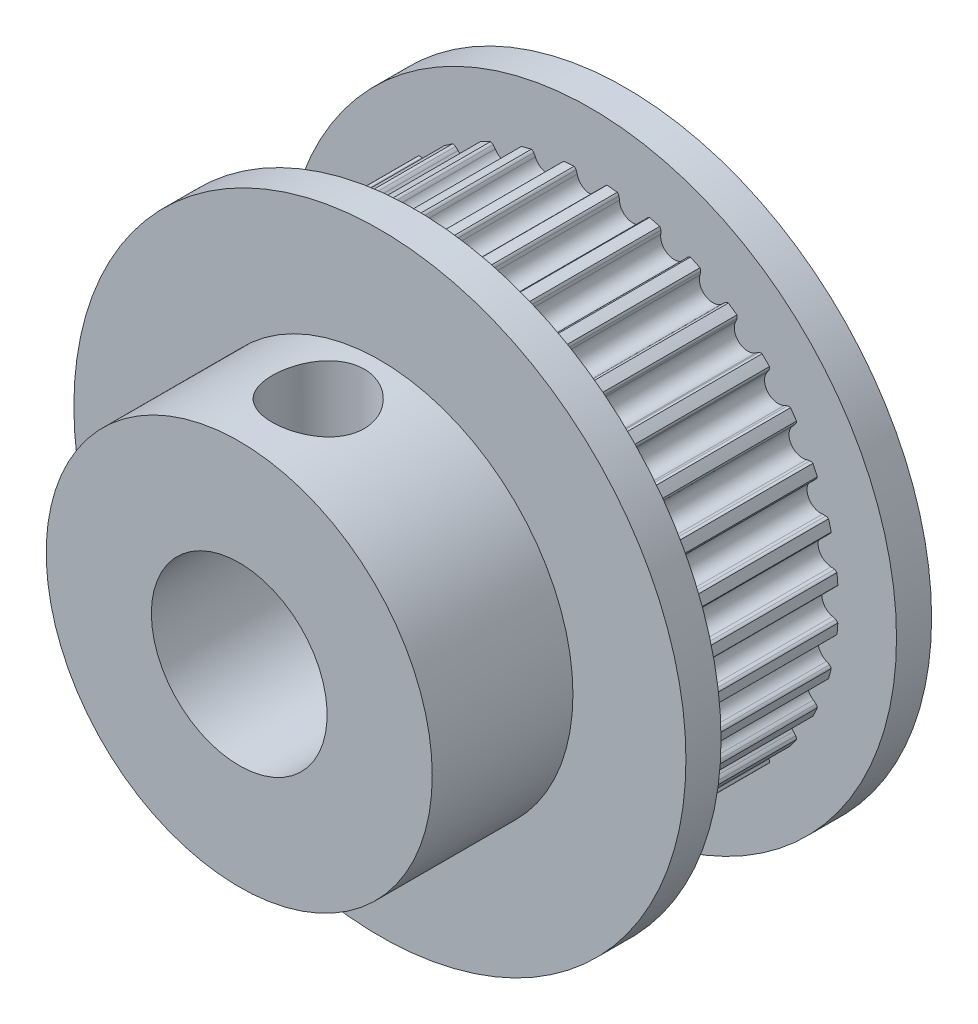
from build123d import *

# Parameters (mm, degrees)
SKETCH1_W            = 13.843
SKETCH1_H            = 1.5875
BOSS_EXTRUDE1_DEPTH  = 7.9375
BOSS_EXTRUDE2_START  = -1.5875
SKETCH3_R            = 13.843
BOSS_EXTRUDE2_DEPTH  = 1.5875
SKETCH4_R            = 8.73125
BOSS_EXTRUDE3_DEPTH  = 6.3627
M7_CLEARANCE_HOLE1_D = 7.9502
SKETCH7_W            = 2.0828
SKETCH7_H            = 10.457240976


with BuildPart() as part:
    # Sketch1 → Revolve1 (revolve)
    with BuildSketch(Plane(origin=(0, 0, 0), x_dir=(1, 0, 0), z_dir=(0, 1, 0))):
        with Locations((6.9215, -4.7625)):
            Rectangle(SKETCH1_W, SKETCH1_H)
    revolve(axis=Axis((0, 0, 3.96875), (0, 0, 1)))

    # Sketch2 → Boss-Extrude1 (add)
    with BuildSketch(Plane(origin=(0, 0, 3.96875), x_dir=(-1, 0, 0), z_dir=(0, 0, -1))):
        with BuildLine():
            ThreePointArc((-3.130872157, 10.768178971), (-2.902422654, 10.831988809), (-2.672674661, 10.89095262))
            ThreePointArc((-2.672674661, 10.89095262), (-2.613516844, 10.858268025), (-2.566342482, 10.809868545))
            ThreePointArc((-2.566342482, 10.809868545), (-2.525361974, 10.745532294), (-2.492197715, 10.676839592))
            ThreePointArc((-2.492197715, 10.676839592), (-1.81719345, 10.305816174), (-1.309794405, 10.885329198))
            ThreePointArc((-1.309794405, 10.885329198), (-1.302124483, 10.961222067), (-1.285619696, 11.035694527))
            ThreePointArc((-1.285619696, 11.035694527), (-1.257843893, 11.097309743), (-1.213432519, 11.148256381))
            ThreePointArc((-1.213432519, 11.148256381), (-0.977373215, 11.171426964), (-0.740876652, 11.189599662))
            ThreePointArc((-0.740876652, 11.189599662), (-0.688293196, 11.147138972), (-0.65024, 11.091283047))
            ThreePointArc((-0.65024, 11.091283047), (-0.62105395, 11.020808018), (-0.600321894, 10.9474))
            ThreePointArc((-0.600321894, 10.9474), (0, 10.4648), (0.600321894, 10.9474))
            ThreePointArc((0.600321894, 10.9474), (0.62105395, 11.020808018), (0.65024, 11.091283047))
            ThreePointArc((0.65024, 11.091283047), (0.688293196, 11.147138972), (0.740876652, 11.189599662))
            ThreePointArc((0.740876652, 11.189599662), (0.977373215, 11.171426964), (1.213432519, 11.148256381))
            ThreePointArc((1.213432519, 11.148256381), (1.257843893, 11.097309743), (1.285619696, 11.035694527))
            ThreePointArc((1.285619696, 11.035694527), (1.302124483, 10.961222067), (1.309794405, 10.885329198))
            ThreePointArc((1.309794405, 10.885329198), (1.81719345, 10.305816174), (2.492197715, 10.676839592))
            ThreePointArc((2.492197715, 10.676839592), (2.525361974, 10.745532294), (2.566342482, 10.809868545))
            ThreePointArc((2.566342482, 10.809868545), (2.613516844, 10.858268025), (2.672674661, 10.89095262))
            ThreePointArc((2.672674661, 10.89095262), (2.902422654, 10.831988809), (3.130872157, 10.768178971))
            ThreePointArc((3.130872157, 10.768178971), (3.165762032, 10.710294373), (3.182416488, 10.644792012))
            ThreePointArc((3.182416488, 10.644792012), (3.185738524, 10.56858493), (3.180113263, 10.492513177))
            ThreePointArc((3.180113263, 10.492513177), (3.579172396, 9.833695338), (4.308349371, 10.081868817))
            ThreePointArc((4.308349371, 10.081868817), (4.352938152, 10.143759008), (4.404467947, 10.200001656))
            ThreePointArc((4.404467947, 10.200001656), (4.459330106, 10.239474098), (4.523264803, 10.261389493))
            ThreePointArc((4.523264803, 10.261389493), (4.739283449, 10.163426155), (4.953181829, 10.060915892))
            ThreePointArc((4.953181829, 10.060915892), (4.977490093, 9.997852127), (4.982517165, 9.930452879))
            ThreePointArc((4.982517165, 9.930452879), (4.972555511, 9.854826689), (4.95380599, 9.780887452))
            ThreePointArc((4.95380599, 9.780887452), (5.2324, 9.062782646), (5.99359401, 9.180565559))
            ThreePointArc((5.99359401, 9.180565559), (6.048252507, 9.233772738), (6.108765882, 9.280212879))
            ThreePointArc((6.108765882, 9.280212879), (6.169648879, 9.309558932), (6.236417833, 9.320039239))
            ThreePointArc((6.236417833, 9.320039239), (6.432143515, 9.18605294), (6.624991577, 9.047956974))
            ThreePointArc((6.624991577, 9.047956974), (6.637979637, 8.981630204), (6.631226579, 8.914381961))
            ThreePointArc((6.631226579, 8.914381961), (6.608283915, 8.841634525), (6.576979828, 8.772074412))
            ThreePointArc((6.576979828, 8.772074412), (6.726643778, 8.016501888), (7.496726329, 8.000315462))
            ThreePointArc((7.496726329, 8.000315462), (7.55979377, 8.043222957), (7.627452057, 8.07844953))
            ThreePointArc((7.627452057, 8.07844953), (7.692505993, 8.096777528), (7.760080463, 8.095504309))
            ThreePointArc((7.760080463, 8.095504309), (7.929566155, 7.929566155), (8.095504309, 7.760080463))
            ThreePointArc((8.095504309, 7.760080463), (8.096777528, 7.692505993), (8.07844953, 7.627452057))
            ThreePointArc((8.07844953, 7.627452057), (8.043222957, 7.55979377), (8.000315462, 7.496726329))
            ThreePointArc((8.000315462, 7.496726329), (8.016501888, 6.726643778), (8.772074412, 6.576979828))
            ThreePointArc((8.772074412, 6.576979828), (8.841634525, 6.608283915), (8.914381961, 6.631226579))
            ThreePointArc((8.914381961, 6.631226579), (8.981630204, 6.637979637), (9.047956974, 6.624991577))
            ThreePointArc((9.047956974, 6.624991577), (9.18605294, 6.432143515), (9.320039239, 6.236417833))
            ThreePointArc((9.320039239, 6.236417833), (9.309558932, 6.169648879), (9.280212879, 6.108765882))
            ThreePointArc((9.280212879, 6.108765882), (9.233772738, 6.048252507), (9.180565559, 5.99359401))
            ThreePointArc((9.180565559, 5.99359401), (9.062782646, 5.2324), (9.780887452, 4.95380599))
            ThreePointArc((9.780887452, 4.95380599), (9.854826689, 4.972555511), (9.930452879, 4.982517165))
            ThreePointArc((9.930452879, 4.982517165), (9.997852127, 4.977490093), (10.060915892, 4.953181829))
            ThreePointArc((10.060915892, 4.953181829), (10.163426155, 4.739283449), (10.261389493, 4.523264803))
            ThreePointArc((10.261389493, 4.523264803), (10.239474098, 4.459330106), (10.200001656, 4.404467947))
            ThreePointArc((10.200001656, 4.404467947), (10.143759008, 4.352938152), (10.081868817, 4.308349371))
            ThreePointArc((10.081868817, 4.308349371), (9.833695338, 3.579172396), (10.492513177, 3.180113263))
            ThreePointArc((10.492513177, 3.180113263), (10.56858493, 3.185738524), (10.644792012, 3.182416488))
            ThreePointArc((10.644792012, 3.182416488), (10.710294373, 3.165762032), (10.768178971, 3.130872157))
            ThreePointArc((10.768178971, 3.130872157), (10.831988809, 2.902422654), (10.89095262, 2.672674661))
            ThreePointArc((10.89095262, 2.672674661), (10.858268025, 2.613516844), (10.809868545, 2.566342482))
            ThreePointArc((10.809868545, 2.566342482), (10.745532294, 2.525361974), (10.676839592, 2.492197715))
            ThreePointArc((10.676839592, 2.492197715), (10.305816174, 1.81719345), (10.885329198, 1.309794405))
            ThreePointArc((10.885329198, 1.309794405), (10.961222067, 1.302124483), (11.035694527, 1.285619696))
            ThreePointArc((11.035694527, 1.285619696), (11.097309743, 1.257843893), (11.148256381, 1.213432519))
            ThreePointArc((11.148256381, 1.213432519), (11.171426964, 0.977373215), (11.189599662, 0.740876652))
            ThreePointArc((11.189599662, 0.740876652), (11.147138972, 0.688293196), (11.091283047, 0.65024))
            ThreePointArc((11.091283047, 0.65024), (11.020808018, 0.62105395), (10.9474, 0.600321894))
            ThreePointArc((10.9474, 0.600321894), (10.4648, 0), (10.9474, -0.600321894))
            ThreePointArc((10.9474, -0.600321894), (11.020808018, -0.62105395), (11.091283047, -0.65024))
            ThreePointArc((11.091283047, -0.65024), (11.147138972, -0.688293196), (11.189599662, -0.740876652))
            ThreePointArc((11.189599662, -0.740876652), (11.171426964, -0.977373215), (11.148256381, -1.213432519))
            ThreePointArc((11.148256381, -1.213432519), (11.097309743, -1.257843893), (11.035694527, -1.285619696))
            ThreePointArc((11.035694527, -1.285619696), (10.961222067, -1.302124483), (10.885329198, -1.309794405))
            ThreePointArc((10.885329198, -1.309794405), (10.305816174, -1.81719345), (10.676839592, -2.492197715))
            ThreePointArc((10.676839592, -2.492197715), (10.745532294, -2.525361974), (10.809868545, -2.566342482))
            ThreePointArc((10.809868545, -2.566342482), (10.858268025, -2.613516844), (10.89095262, -2.672674661))
            ThreePointArc((10.89095262, -2.672674661), (10.831988809, -2.902422654), (10.768178971, -3.130872157))
            ThreePointArc((10.768178971, -3.130872157), (10.710294373, -3.165762032), (10.644792012, -3.182416488))
            ThreePointArc((10.644792012, -3.182416488), (10.56858493, -3.185738524), (10.492513177, -3.180113263))
            ThreePointArc((10.492513177, -3.180113263), (9.833695338, -3.579172396), (10.081868817, -4.308349371))
            ThreePointArc((10.081868817, -4.308349371), (10.143759008, -4.352938152), (10.200001656, -4.404467947))
            ThreePointArc((10.200001656, -4.404467947), (10.239474098, -4.459330106), (10.261389493, -4.523264803))
            ThreePointArc((10.261389493, -4.523264803), (10.163426155, -4.739283449), (10.060915892, -4.953181829))
            ThreePointArc((10.060915892, -4.953181829), (9.997852127, -4.977490093), (9.930452879, -4.982517165))
            ThreePointArc((9.930452879, -4.982517165), (9.854826689, -4.972555511), (9.780887452, -4.95380599))
            ThreePointArc((9.780887452, -4.95380599), (9.062782646, -5.2324), (9.180565559, -5.99359401))
            ThreePointArc((9.180565559, -5.99359401), (9.233772738, -6.048252507), (9.280212879, -6.108765882))
            ThreePointArc((9.280212879, -6.108765882), (9.309558932, -6.169648879), (9.320039239, -6.236417833))
            ThreePointArc((9.320039239, -6.236417833), (9.18605294, -6.432143515), (9.047956974, -6.624991577))
            ThreePointArc((9.047956974, -6.624991577), (8.981630204, -6.637979637), (8.914381961, -6.631226579))
            ThreePointArc((8.914381961, -6.631226579), (8.841634525, -6.608283915), (8.772074412, -6.576979828))
            ThreePointArc((8.772074412, -6.576979828), (8.016501888, -6.726643778), (8.000315462, -7.496726329))
            ThreePointArc((8.000315462, -7.496726329), (8.043222957, -7.55979377), (8.07844953, -7.627452057))
            ThreePointArc((8.07844953, -7.627452057), (8.096777528, -7.692505993), (8.095504309, -7.760080463))
            ThreePointArc((8.095504309, -7.760080463), (7.929566155, -7.929566155), (7.760080463, -8.095504309))
            ThreePointArc((7.760080463, -8.095504309), (7.692505993, -8.096777528), (7.627452057, -8.07844953))
            ThreePointArc((7.627452057, -8.07844953), (7.55979377, -8.043222957), (7.496726329, -8.000315462))
            ThreePointArc((7.496726329, -8.000315462), (6.726643778, -8.016501888), (6.576979828, -8.772074412))
            ThreePointArc((6.576979828, -8.772074412), (6.608283915, -8.841634525), (6.631226579, -8.914381961))
            ThreePointArc((6.631226579, -8.914381961), (6.637979637, -8.981630204), (6.624991577, -9.047956974))
            ThreePointArc((6.624991577, -9.047956974), (6.432143515, -9.18605294), (6.236417833, -9.320039239))
            ThreePointArc((6.236417833, -9.320039239), (6.169648879, -9.309558932), (6.108765882, -9.280212879))
            ThreePointArc((6.108765882, -9.280212879), (6.048252507, -9.233772738), (5.99359401, -9.180565559))
            ThreePointArc((5.99359401, -9.180565559), (5.2324, -9.062782646), (4.95380599, -9.780887452))
            ThreePointArc((4.95380599, -9.780887452), (4.972555511, -9.854826689), (4.982517165, -9.930452879))
            ThreePointArc((4.982517165, -9.930452879), (4.977490093, -9.997852127), (4.953181829, -10.060915892))
            ThreePointArc((4.953181829, -10.060915892), (4.739283449, -10.163426155), (4.523264803, -10.261389493))
            ThreePointArc((4.523264803, -10.261389493), (4.459330106, -10.239474098), (4.404467947, -10.200001656))
            ThreePointArc((4.404467947, -10.200001656), (4.352938152, -10.143759008), (4.308349371, -10.081868817))
            ThreePointArc((4.308349371, -10.081868817), (3.579172396, -9.833695338), (3.180113263, -10.492513177))
            ThreePointArc((3.180113263, -10.492513177), (3.185738524, -10.56858493), (3.182416488, -10.644792012))
            ThreePointArc((3.182416488, -10.644792012), (3.165762032, -10.710294373), (3.130872157, -10.768178971))
            ThreePointArc((3.130872157, -10.768178971), (2.902422654, -10.831988809), (2.672674661, -10.89095262))
            ThreePointArc((2.672674661, -10.89095262), (2.613516844, -10.858268025), (2.566342482, -10.809868545))
            ThreePointArc((2.566342482, -10.809868545), (2.525361974, -10.745532294), (2.492197715, -10.676839592))
            ThreePointArc((2.492197715, -10.676839592), (1.81719345, -10.305816174), (1.309794405, -10.885329198))
            ThreePointArc((1.309794405, -10.885329198), (1.302124483, -10.961222067), (1.285619696, -11.035694527))
            ThreePointArc((1.285619696, -11.035694527), (1.257843893, -11.097309743), (1.213432519, -11.148256381))
            ThreePointArc((1.213432519, -11.148256381), (0.977373215, -11.171426964), (0.740876652, -11.189599662))
            ThreePointArc((0.740876652, -11.189599662), (0.688293196, -11.147138972), (0.65024, -11.091283047))
            ThreePointArc((0.65024, -11.091283047), (0.62105395, -11.020808018), (0.600321894, -10.9474))
            ThreePointArc((0.600321894, -10.9474), (0, -10.4648), (-0.600321894, -10.9474))
            ThreePointArc((-0.600321894, -10.9474), (-0.62105395, -11.020808018), (-0.65024, -11.091283047))
            ThreePointArc((-0.65024, -11.091283047), (-0.688293196, -11.147138972), (-0.740876652, -11.189599662))
            ThreePointArc((-0.740876652, -11.189599662), (-0.977373215, -11.171426964), (-1.213432519, -11.148256381))
            ThreePointArc((-1.213432519, -11.148256381), (-1.257843893, -11.097309743), (-1.285619696, -11.035694527))
            ThreePointArc((-1.285619696, -11.035694527), (-1.302124483, -10.961222067), (-1.309794405, -10.885329198))
            ThreePointArc((-1.309794405, -10.885329198), (-1.81719345, -10.305816174), (-2.492197715, -10.676839592))
            ThreePointArc((-2.492197715, -10.676839592), (-2.525361974, -10.745532294), (-2.566342482, -10.809868545))
            ThreePointArc((-2.566342482, -10.809868545), (-2.613516844, -10.858268025), (-2.672674661, -10.89095262))
            ThreePointArc((-2.672674661, -10.89095262), (-2.902422654, -10.831988809), (-3.130872157, -10.768178971))
            ThreePointArc((-3.130872157, -10.768178971), (-3.165762032, -10.710294373), (-3.182416488, -10.644792012))
            ThreePointArc((-3.182416488, -10.644792012), (-3.185738524, -10.56858493), (-3.180113263, -10.492513177))
            ThreePointArc((-3.180113263, -10.492513177), (-3.579172396, -9.833695338), (-4.308349371, -10.081868817))
            ThreePointArc((-4.308349371, -10.081868817), (-4.352938152, -10.143759008), (-4.404467947, -10.200001656))
            ThreePointArc((-4.404467947, -10.200001656), (-4.459330106, -10.239474098), (-4.523264803, -10.261389493))
            ThreePointArc((-4.523264803, -10.261389493), (-4.739283449, -10.163426155), (-4.953181829, -10.060915892))
            ThreePointArc((-4.953181829, -10.060915892), (-4.977490093, -9.997852127), (-4.982517165, -9.930452879))
            ThreePointArc((-4.982517165, -9.930452879), (-4.972555511, -9.854826689), (-4.95380599, -9.780887452))
            ThreePointArc((-4.95380599, -9.780887452), (-5.2324, -9.062782646), (-5.99359401, -9.180565559))
            ThreePointArc((-5.99359401, -9.180565559), (-6.048252507, -9.233772738), (-6.108765882, -9.280212879))
            ThreePointArc((-6.108765882, -9.280212879), (-6.169648879, -9.309558932), (-6.236417833, -9.320039239))
            ThreePointArc((-6.236417833, -9.320039239), (-6.432143515, -9.18605294), (-6.624991577, -9.047956974))
            ThreePointArc((-6.624991577, -9.047956974), (-6.637979637, -8.981630204), (-6.631226579, -8.914381961))
            ThreePointArc((-6.631226579, -8.914381961), (-6.608283915, -8.841634525), (-6.576979828, -8.772074412))
            ThreePointArc((-6.576979828, -8.772074412), (-6.726643778, -8.016501888), (-7.496726329, -8.000315462))
            ThreePointArc((-7.496726329, -8.000315462), (-7.55979377, -8.043222957), (-7.627452057, -8.07844953))
            ThreePointArc((-7.627452057, -8.07844953), (-7.692505993, -8.096777528), (-7.760080463, -8.095504309))
            ThreePointArc((-7.760080463, -8.095504309), (-7.929566155, -7.929566155), (-8.095504309, -7.760080463))
            ThreePointArc((-8.095504309, -7.760080463), (-8.096777528, -7.692505993), (-8.07844953, -7.627452057))
            ThreePointArc((-8.07844953, -7.627452057), (-8.043222957, -7.55979377), (-8.000315462, -7.496726329))
            ThreePointArc((-8.000315462, -7.496726329), (-8.016501888, -6.726643778), (-8.772074412, -6.576979828))
            ThreePointArc((-8.772074412, -6.576979828), (-8.841634525, -6.608283915), (-8.914381961, -6.631226579))
            ThreePointArc((-8.914381961, -6.631226579), (-8.981630204, -6.637979637), (-9.047956974, -6.624991577))
            ThreePointArc((-9.047956974, -6.624991577), (-9.18605294, -6.432143515), (-9.320039239, -6.236417833))
            ThreePointArc((-9.320039239, -6.236417833), (-9.309558932, -6.169648879), (-9.280212879, -6.108765882))
            ThreePointArc((-9.280212879, -6.108765882), (-9.233772738, -6.048252507), (-9.180565559, -5.99359401))
            ThreePointArc((-9.180565559, -5.99359401), (-9.062782646, -5.2324), (-9.780887452, -4.95380599))
            ThreePointArc((-9.780887452, -4.95380599), (-9.854826689, -4.972555511), (-9.930452879, -4.982517165))
            ThreePointArc((-9.930452879, -4.982517165), (-9.997852127, -4.977490093), (-10.060915892, -4.953181829))
            ThreePointArc((-10.060915892, -4.953181829), (-10.163426155, -4.739283449), (-10.261389493, -4.523264803))
            ThreePointArc((-10.261389493, -4.523264803), (-10.239474098, -4.459330106), (-10.200001656, -4.404467947))
            ThreePointArc((-10.200001656, -4.404467947), (-10.143759008, -4.352938152), (-10.081868817, -4.308349371))
            ThreePointArc((-10.081868817, -4.308349371), (-9.833695338, -3.579172396), (-10.492513177, -3.180113263))
            ThreePointArc((-10.492513177, -3.180113263), (-10.56858493, -3.185738524), (-10.644792012, -3.182416488))
            ThreePointArc((-10.644792012, -3.182416488), (-10.710294373, -3.165762032), (-10.768178971, -3.130872157))
            ThreePointArc((-10.768178971, -3.130872157), (-10.831988809, -2.902422654), (-10.89095262, -2.672674661))
            ThreePointArc((-10.89095262, -2.672674661), (-10.858268025, -2.613516844), (-10.809868545, -2.566342482))
            ThreePointArc((-10.809868545, -2.566342482), (-10.745532294, -2.525361974), (-10.676839592, -2.492197715))
            ThreePointArc((-10.676839592, -2.492197715), (-10.305816174, -1.81719345), (-10.885329198, -1.309794405))
            ThreePointArc((-10.885329198, -1.309794405), (-10.961222067, -1.302124483), (-11.035694527, -1.285619696))
            ThreePointArc((-11.035694527, -1.285619696), (-11.097309743, -1.257843893), (-11.148256381, -1.213432519))
            ThreePointArc((-11.148256381, -1.213432519), (-11.171426964, -0.977373215), (-11.189599662, -0.740876652))
            ThreePointArc((-11.189599662, -0.740876652), (-11.147138972, -0.688293196), (-11.091283047, -0.65024))
            ThreePointArc((-11.091283047, -0.65024), (-11.020808018, -0.62105395), (-10.9474, -0.600321894))
            ThreePointArc((-10.9474, -0.600321894), (-10.4648, 0), (-10.9474, 0.600321894))
            ThreePointArc((-10.9474, 0.600321894), (-11.020808018, 0.62105395), (-11.091283047, 0.65024))
            ThreePointArc((-11.091283047, 0.65024), (-11.147138972, 0.688293196), (-11.189599662, 0.740876652))
            ThreePointArc((-11.189599662, 0.740876652), (-11.171426964, 0.977373215), (-11.148256381, 1.213432519))
            ThreePointArc((-11.148256381, 1.213432519), (-11.097309743, 1.257843893), (-11.035694527, 1.285619696))
            ThreePointArc((-11.035694527, 1.285619696), (-10.961222067, 1.302124483), (-10.885329198, 1.309794405))
            ThreePointArc((-10.885329198, 1.309794405), (-10.305816174, 1.81719345), (-10.676839592, 2.492197715))
            ThreePointArc((-10.676839592, 2.492197715), (-10.745532294, 2.525361974), (-10.809868545, 2.566342482))
            ThreePointArc((-10.809868545, 2.566342482), (-10.858268025, 2.613516844), (-10.89095262, 2.672674661))
            ThreePointArc((-10.89095262, 2.672674661), (-10.831988809, 2.902422654), (-10.768178971, 3.130872157))
            ThreePointArc((-10.768178971, 3.130872157), (-10.710294373, 3.165762032), (-10.644792012, 3.182416488))
            ThreePointArc((-10.644792012, 3.182416488), (-10.56858493, 3.185738524), (-10.492513177, 3.180113263))
            ThreePointArc((-10.492513177, 3.180113263), (-9.833695338, 3.579172396), (-10.081868817, 4.308349371))
            ThreePointArc((-10.081868817, 4.308349371), (-10.143759008, 4.352938152), (-10.200001656, 4.404467947))
            ThreePointArc((-10.200001656, 4.404467947), (-10.239474098, 4.459330106), (-10.261389493, 4.523264803))
            ThreePointArc((-10.261389493, 4.523264803), (-10.163426155, 4.739283449), (-10.060915892, 4.953181829))
            ThreePointArc((-10.060915892, 4.953181829), (-9.997852127, 4.977490093), (-9.930452879, 4.982517165))
            ThreePointArc((-9.930452879, 4.982517165), (-9.854826689, 4.972555511), (-9.780887452, 4.95380599))
            ThreePointArc((-9.780887452, 4.95380599), (-9.062782646, 5.2324), (-9.180565559, 5.99359401))
            ThreePointArc((-9.180565559, 5.99359401), (-9.233772738, 6.048252507), (-9.280212879, 6.108765882))
            ThreePointArc((-9.280212879, 6.108765882), (-9.309558932, 6.169648879), (-9.320039239, 6.236417833))
            ThreePointArc((-9.320039239, 6.236417833), (-9.18605294, 6.432143515), (-9.047956974, 6.624991577))
            ThreePointArc((-9.047956974, 6.624991577), (-8.981630204, 6.637979637), (-8.914381961, 6.631226579))
            ThreePointArc((-8.914381961, 6.631226579), (-8.841634525, 6.608283915), (-8.772074412, 6.576979828))
            ThreePointArc((-8.772074412, 6.576979828), (-8.016501888, 6.726643778), (-8.000315462, 7.496726329))
            ThreePointArc((-8.000315462, 7.496726329), (-8.043222957, 7.55979377), (-8.07844953, 7.627452057))
            ThreePointArc((-8.07844953, 7.627452057), (-8.096777528, 7.692505993), (-8.095504309, 7.760080463))
            ThreePointArc((-8.095504309, 7.760080463), (-7.929566155, 7.929566155), (-7.760080463, 8.095504309))
            ThreePointArc((-7.760080463, 8.095504309), (-7.692505993, 8.096777528), (-7.627452057, 8.07844953))
            ThreePointArc((-7.627452057, 8.07844953), (-7.55979377, 8.043222957), (-7.496726329, 8.000315462))
            ThreePointArc((-7.496726329, 8.000315462), (-6.726643778, 8.016501888), (-6.576979828, 8.772074412))
            ThreePointArc((-6.576979828, 8.772074412), (-6.608283915, 8.841634525), (-6.631226579, 8.914381961))
            ThreePointArc((-6.631226579, 8.914381961), (-6.637979637, 8.981630204), (-6.624991577, 9.047956974))
            ThreePointArc((-6.624991577, 9.047956974), (-6.432143515, 9.18605294), (-6.236417833, 9.320039239))
            ThreePointArc((-6.236417833, 9.320039239), (-6.169648879, 9.309558932), (-6.108765882, 9.280212879))
            ThreePointArc((-6.108765882, 9.280212879), (-6.048252507, 9.233772738), (-5.99359401, 9.180565559))
            ThreePointArc((-5.99359401, 9.180565559), (-5.2324, 9.062782646), (-4.95380599, 9.780887452))
            ThreePointArc((-4.95380599, 9.780887452), (-4.972555511, 9.854826689), (-4.982517165, 9.930452879))
            ThreePointArc((-4.982517165, 9.930452879), (-4.977490093, 9.997852127), (-4.953181829, 10.060915892))
            ThreePointArc((-4.953181829, 10.060915892), (-4.739283449, 10.163426155), (-4.523264803, 10.261389493))
            ThreePointArc((-4.523264803, 10.261389493), (-4.459330106, 10.239474098), (-4.404467947, 10.200001656))
            ThreePointArc((-4.404467947, 10.200001656), (-4.352938152, 10.143759008), (-4.308349371, 10.081868817))
            ThreePointArc((-4.308349371, 10.081868817), (-3.579172396, 9.833695338), (-3.180113263, 10.492513177))
            ThreePointArc((-3.180113263, 10.492513177), (-3.185738524, 10.56858493), (-3.182416488, 10.644792012))
            ThreePointArc((-3.182416488, 10.644792012), (-3.165762032, 10.710294373), (-3.130872157, 10.768178971))
        make_face()
    extrude(amount=BOSS_EXTRUDE1_DEPTH)

    # Sketch3 → Boss-Extrude2 (add)
    with BuildSketch(Plane.XY.offset(-3.96875).offset(BOSS_EXTRUDE2_START)):
        Circle(SKETCH3_R)
    extrude(amount=BOSS_EXTRUDE2_DEPTH)

    # Sketch4 → Boss-Extrude3 (add)
    with BuildSketch(Plane.XY.offset(5.55625)):
        Circle(SKETCH4_R)
    extrude(amount=BOSS_EXTRUDE3_DEPTH)

    # M7 Clearance Hole1 (through all)
    with Locations(Plane(origin=(0, 0, -5.55625), x_dir=(-1, 0, 0), z_dir=(0, 0, -1))):
        with Locations((0, 0)):
            Hole(M7_CLEARANCE_HOLE1_D / 2)

    # Sketch7 → M3.5 Clearance Hole1 (revolve, cut)
    with BuildSketch(Plane(origin=(0, 3.385759024, 8.347075), x_dir=(0, 0, -1), z_dir=(1, 0, 0))):
        with Locations((1.0414, 5.228620488)):
            Rectangle(SKETCH7_W, SKETCH7_H)
    revolve(axis=Axis((0, -2.964240976, 8.347075), (0, 1, 0)), mode=Mode.SUBTRACT)


solid = part.part
